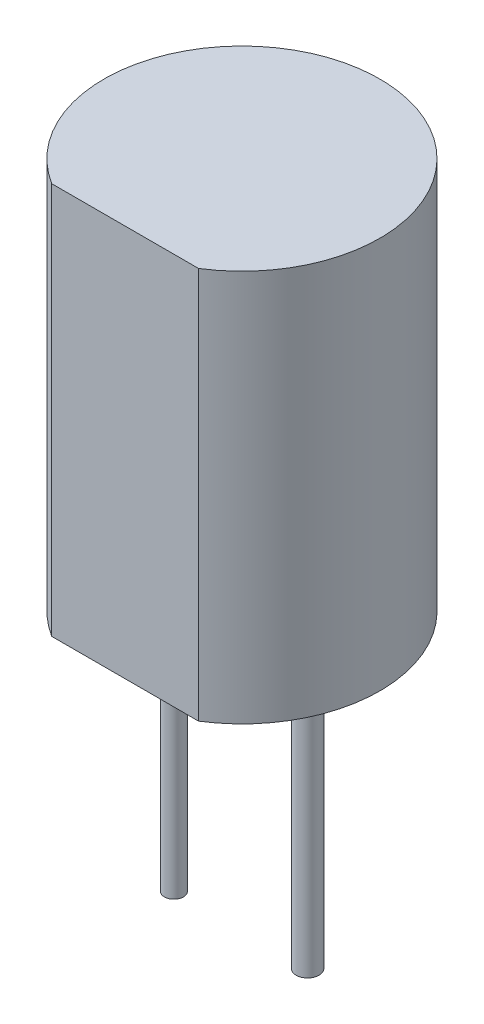
from build123d import *

# Parameters (mm, degrees)
SKETCH1_R           = 1.55
BOSS_EXTRUDE1_DEPTH = 5.4
SKETCH2_R           = 0.15783532
SKETCH2_R_2         = 0.131217629
BOSS_EXTRUDE2_DEPTH = 3.81


with BuildPart() as part:
    # Sketch1 → Boss-Extrude1 (new body)
    # profile 1 of 2: a face of its own
    with BuildSketch(Plane(origin=(0, 0, 0), x_dir=(1, 0, 0), z_dir=(0, 1, 0))):
        with BuildLine():
            Line((-1.010787693, -1.608822004), (1.010787693, -1.608822004))
            ThreePointArc((1.010787693, -1.608822004), (0, 1.9), (-1.010787693, -1.608822004))
        make_face()
        Circle(SKETCH1_R, mode=Mode.SUBTRACT)
    # profile 2 of 2: a face of its own
    with BuildSketch(Plane(origin=(0, 0, 0), x_dir=(1, 0, 0), z_dir=(0, 1, 0))):
        Circle(SKETCH1_R)
    extrude(amount=BOSS_EXTRUDE1_DEPTH)

    # Sketch2 → Boss-Extrude2 (add)
    with BuildSketch(Plane.XZ):
        with Locations(Location((0.904579412, 0, 0), (0, 0, 90))):
            Circle(SKETCH2_R)
        with Locations(Location((-0.93688582, 0, 0), (0, 0, 90))):
            Circle(SKETCH2_R_2)
    extrude(amount=BOSS_EXTRUDE2_DEPTH)


solid = part.part
